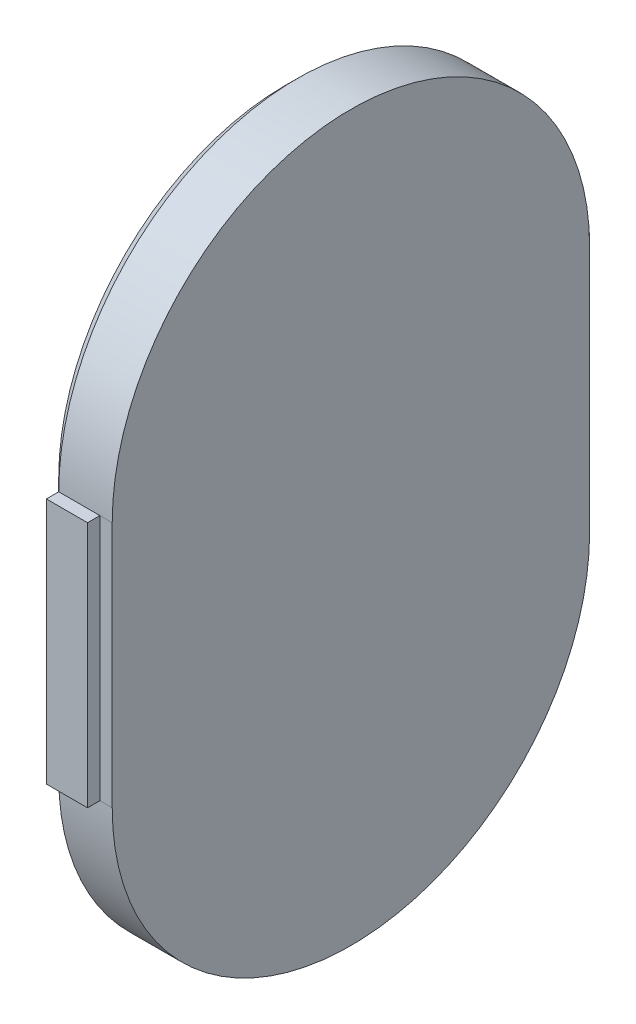
from build123d import *

# Parameters (mm, degrees)
BOSS_EXTRUDE1_START = -63
BOSS_EXTRUDE1_DEPTH = 1.6
CHAMFER1_SIZE       = 0.3
BOSS_EXTRUDE2_START = 61.3
SKETCH2_W           = 1
SKETCH2_H           = 6
BOSS_EXTRUDE2_DEPTH = 0.31
BOSS_EXTRUDE3_START = 73.19
SKETCH3_W           = 1
SKETCH3_H           = 6
BOSS_EXTRUDE3_DEPTH = 0.31
BOSS_EXTRUDE4_START = 65.9
SKETCH4_W           = 0.7
SKETCH4_H           = 1.3
BOSS_EXTRUDE4_DEPTH = 3


with BuildPart() as part:
    # Sketch1 → Boss-Extrude1 (new body)
    with BuildSketch(Plane(origin=(0, 0, 0), x_dir=(0, 0, -1), z_dir=(1, 0, 0)).offset(BOSS_EXTRUDE1_START)):
        with BuildLine():
            Line((-73.2, 110), (-73.2, 116))
            ThreePointArc((-73.2, 116), (-71.501219331, 120.101219331), (-67.4, 121.8))
            ThreePointArc((-67.4, 121.8), (-63.298780669, 120.101219331), (-61.6, 116))
            Line((-61.6, 116), (-61.6, 110))
            ThreePointArc((-61.6, 110), (-63.298780669, 105.898780669), (-67.4, 104.2))
            ThreePointArc((-67.4, 104.2), (-71.501219331, 105.898780669), (-73.2, 110))
        make_face()
    extrude(amount=BOSS_EXTRUDE1_DEPTH)

    # Chamfer1
    chamfer1_edges = [part.edges().sort_by_distance(p)[0] for p in [
        (-63, 104.2, 67.4),
        (-63, 113, 73.2),
        (-63, 121.8, 67.4),
        (-63, 113, 61.6),
    ]]
    chamfer(chamfer1_edges, length=CHAMFER1_SIZE)

    # Sketch2 → Boss-Extrude2 (add)
    with BuildSketch(Plane.XY.offset(BOSS_EXTRUDE2_START)):
        with Locations((-62.2, 113)):
            Rectangle(SKETCH2_W, SKETCH2_H)
    extrude(amount=BOSS_EXTRUDE2_DEPTH)

    # Sketch3 → Boss-Extrude3 (add)
    with BuildSketch(Plane.XY.offset(BOSS_EXTRUDE3_START)):
        with Locations((-62.2, 113)):
            Rectangle(SKETCH3_W, SKETCH3_H)
    extrude(amount=BOSS_EXTRUDE3_DEPTH)


with BuildPart() as body_2:
    # Sketch4 → Boss-Extrude4 (new body)
    with BuildSketch(Plane.XY.offset(BOSS_EXTRUDE4_START)):
        with Locations((-62.75, 104.75)):
            Rectangle(SKETCH4_W, SKETCH4_H)
    extrude(amount=BOSS_EXTRUDE4_DEPTH)


with BuildPart() as part_1:
    add(part.part)

    # Combine1: cut body 2
    add(body_2.part, mode=Mode.SUBTRACT)


solid = part_1.part
